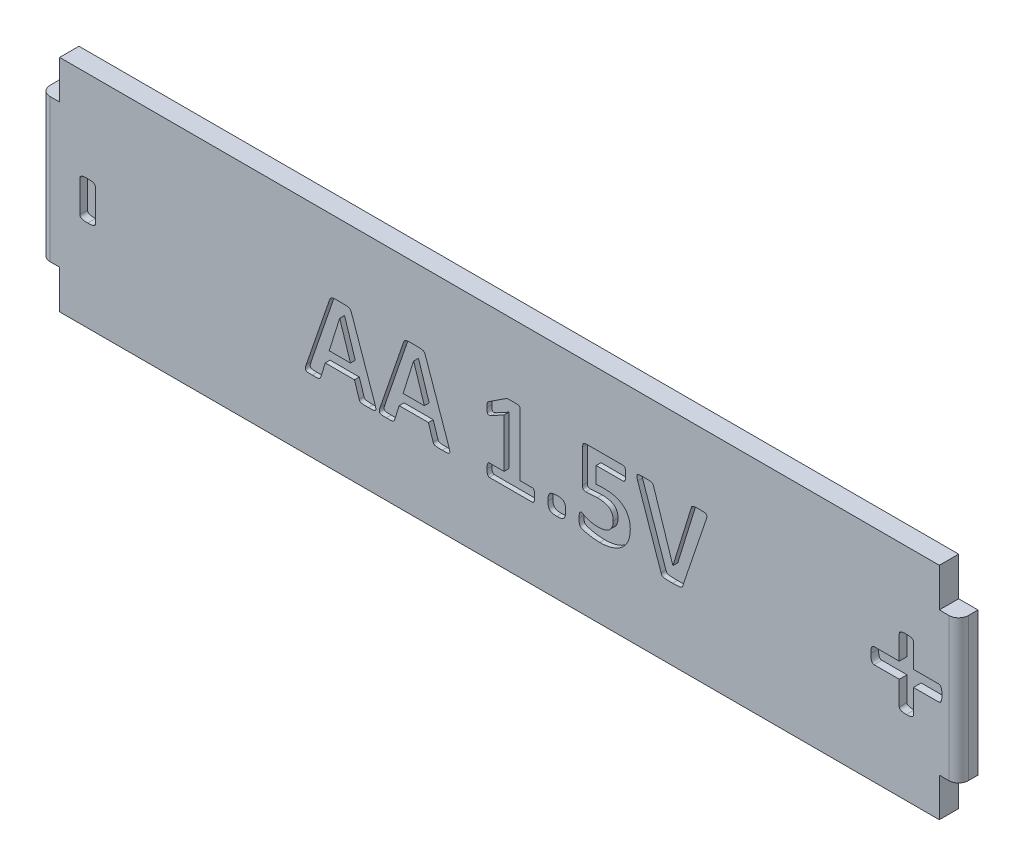
from build123d import *

# Parameters (mm, degrees)
BOSS_EXTRUDE1_DEPTH = 1
FILLET1_R           = 0.5
CUT_EXTRUDE1_DEPTH  = 0.25
SKETCH4_W           = 2.1
SKETCH4_H           = 2.1
CUT_EXTRUDE3_DEPTH  = 0.7
FILLET2_R           = 0.4
CUT_EXTRUDE4_DEPTH  = 0.4


with BuildPart() as part:
    # Sketch1 → Boss-Extrude1 (new body)
    with BuildSketch(Plane.XY):
        Polygon((-22.75, -5.7), (22.75, -5.7), (22.75, -3.7), (23.75, -3.7), (23.75, 3.7), (22.75, 3.7), (22.75, 5.7), (-22.75, 5.7), (-22.75, 3.7), (-23.75, 3.7), (-23.75, -3.7), (-22.75, -3.7), align=None)
    extrude(amount=BOSS_EXTRUDE1_DEPTH)

    # Fillet1
    fillet1_edges = [part.edges().sort_by_distance(p)[0] for p in [
        (-23.75, 0, 1),
        (23.75, 0, 1),
    ]]
    fillet(fillet1_edges, radius=FILLET1_R)

    # Sketch2 → Cut-Extrude1 (cut)
    # profile 1 of 6: a face of its own
    with BuildSketch(Plane.XY.offset(1)):
        with BuildLine():
            add(Edge.make_bspline(
                [(-6.441176471, -1.681066176), (-6.43514215, -1.698463246), (-6.423893064, -1.73089459), (-6.411134097, -1.777714399), (-6.400914328, -1.81840243), (-6.393947438, -1.853881891), (-6.391326647, -1.884608418), (-6.39520632, -1.911109035), (-6.403122486, -1.934523301), (-6.418807872, -1.953302348), (-6.439899264, -1.968606454), (-6.467908333, -1.979050301), (-6.501623162, -1.988432883), (-6.542462837, -1.993400755), (-6.590374631, -1.995378977), (-6.645792762, -1.998848309), (-6.709870331, -1.998953944), (-6.755210304, -1.999635957), (-6.779411765, -2)],
                knots=[0, 0, 0, 0, 1.351975101, 2.52033068, 3.562719996, 4.432170766, 5.176088948, 5.812532786, 6.389296298, 6.965620705, 7.577732788, 8.283941723, 9.146375963, 10.145613058, 11.295182858, 12.669444765, 14.222224263, 16, 16, 16, 16], degree=3))
            add(Edge.make_bspline(
                [(-6.779411765, -2), (-6.804227611, -2.000059076), (-6.851104114, -2.000170668), (-6.916990313, -1.999438733), (-6.974262144, -1.997235534), (-7.035664591, -1.995552473), (-7.097179219, -1.989698559), (-7.156329437, -1.980048369), (-7.198777842, -1.963881988), (-7.227688195, -1.940038839), (-7.24419154, -1.908504263), (-7.252150138, -1.886125934), (-7.256433824, -1.874080882)],
                knots=[0, 0, 0, 0, 1.402041787, 2.648421349, 3.722147351, 4.640185661, 6.117966101, 7.211050041, 8.017924191, 8.656254393, 9.276733986, 10, 10, 10, 10], degree=3))
            Line((-7.256433824, -1.874080882), (-7.500919118, -1.117647059))
            Line((-7.500919118, -1.117647059), (-9.010110294, -1.117647059))
            Line((-9.010110294, -1.117647059), (-9.241727941, -1.852941176))
            add(Edge.make_bspline(
                [(-9.241727941, -1.852941176), (-9.245919816, -1.86624811), (-9.253902368, -1.891588393), (-9.272028902, -1.926589366), (-9.301223981, -1.954190463), (-9.342387527, -1.974913155), (-9.399235471, -1.987349905), (-9.473663173, -1.996392786), (-9.570163526, -1.998447493), (-9.641859217, -1.999442899), (-9.681985294, -2)],
                knots=[0, 0, 0, 0, 0.662368552, 1.261342941, 1.847645799, 2.537239812, 3.42265718, 4.595262896, 6.094463672, 8, 8, 8, 8], degree=3))
            add(Edge.make_bspline(
                [(-9.681985294, -2), (-9.704351499, -1.999769411), (-9.746640373, -1.999333426), (-9.806400512, -1.997568311), (-9.858491194, -1.994780433), (-9.903390712, -1.991668492), (-9.941045498, -1.985572768), (-9.97271125, -1.976296067), (-9.998311499, -1.964078749), (-10.024660548, -1.942534901), (-10.042135205, -1.900772413), (-10.040106686, -1.839358846), (-10.02070276, -1.763253372), (-10.002794458, -1.706685478), (-9.992647059, -1.674632353)],
                knots=[0, 0, 0, 0, 1.279822224, 2.419822313, 3.420424811, 4.264789446, 4.993926375, 5.598399463, 6.14718048, 6.607326483, 7.517039103, 8.604050794, 10.075749779, 12, 12, 12, 12], degree=3))
            Line((-9.992647059, -1.674632353), (-8.783088235, 1.840992647))
            add(Edge.make_bspline(
                [(-8.783088235, 1.840992647), (-8.776768306, 1.856793782), (-8.765081152, 1.886014088), (-8.741799782, 1.925905888), (-8.706874844, 1.95706308), (-8.656070861, 1.97630304), (-8.589651982, 1.990860253), (-8.521210497, 1.995308723), (-8.45527723, 1.997267632), (-8.395539456, 1.99939096), (-8.328127436, 2.000182536), (-8.280637372, 2.000063154), (-8.255514706, 2)],
                knots=[0, 0, 0, 0, 0.856868194, 1.584566637, 2.305859304, 3.162727498, 4.285524966, 5.725550839, 6.605441018, 7.608682037, 8.734971556, 10, 10, 10, 10], degree=3))
            add(Edge.make_bspline(
                [(-8.255514706, 2), (-8.226715577, 2.000060532), (-8.171872879, 2.000175804), (-8.094351935, 1.999407864), (-8.026033407, 1.997289207), (-7.951534629, 1.995274375), (-7.875169887, 1.991036748), (-7.80104759, 1.976372259), (-7.745233752, 1.95675726), (-7.706343614, 1.924201189), (-7.681056865, 1.881268088), (-7.669740277, 1.849195453), (-7.663602941, 1.831801471)],
                knots=[0, 0, 0, 0, 1.298203691, 2.47219252, 3.494555852, 4.378870695, 5.833194716, 6.932857721, 7.781737059, 8.467837287, 9.169060755, 10, 10, 10, 10], degree=3))
            Line((-7.663602941, 1.831801471), (-6.441176471, -1.681066176))
        make_face()
        Polygon((-8.264705882, 1.252757353), (-8.267463235, 1.252757353), (-8.806985294, -0.470588235), (-7.709558824, -0.470588235), align=None, mode=Mode.SUBTRACT)
    # profile 2 of 6: a face of its own
    with BuildSketch(Plane.XY.offset(1)):
        with BuildLine():
            add(Edge.make_bspline(
                [(-2.617647059, -1.681066176), (-2.611612738, -1.698463246), (-2.600363653, -1.73089459), (-2.587604685, -1.777714399), (-2.577384916, -1.81840243), (-2.570418026, -1.853881891), (-2.567797235, -1.884608418), (-2.571676909, -1.911109035), (-2.579593074, -1.934523301), (-2.59527846, -1.953302348), (-2.616369852, -1.968606454), (-2.644378921, -1.979050301), (-2.67809375, -1.988432883), (-2.718933426, -1.993400755), (-2.76684522, -1.995378977), (-2.82226335, -1.998848309), (-2.886340919, -1.998953944), (-2.931680892, -1.999635957), (-2.955882353, -2)],
                knots=[0, 0, 0, 0, 1.351975101, 2.52033068, 3.562719996, 4.432170766, 5.176088948, 5.812532786, 6.389296298, 6.965620705, 7.577732788, 8.283941723, 9.146375963, 10.145613058, 11.295182858, 12.669444765, 14.222224263, 16, 16, 16, 16], degree=3))
            add(Edge.make_bspline(
                [(-2.955882353, -2), (-2.980698199, -2.000059076), (-3.027574703, -2.000170668), (-3.093460901, -1.999438733), (-3.150732732, -1.997235534), (-3.212135179, -1.995552473), (-3.273649807, -1.989698559), (-3.332800026, -1.980048369), (-3.37524843, -1.963881988), (-3.404158783, -1.940038839), (-3.420662129, -1.908504263), (-3.428620726, -1.886125934), (-3.432904412, -1.874080882)],
                knots=[0, 0, 0, 0, 1.402041787, 2.648421349, 3.722147351, 4.640185661, 6.117966101, 7.211050041, 8.017924191, 8.656254393, 9.276733986, 10, 10, 10, 10], degree=3))
            Line((-3.432904412, -1.874080882), (-3.677389706, -1.117647059))
            Line((-3.677389706, -1.117647059), (-5.186580882, -1.117647059))
            Line((-5.186580882, -1.117647059), (-5.418198529, -1.852941176))
            add(Edge.make_bspline(
                [(-5.418198529, -1.852941176), (-5.422390404, -1.86624811), (-5.430372956, -1.891588393), (-5.44849949, -1.926589366), (-5.477694569, -1.954190463), (-5.518858115, -1.974913155), (-5.57570606, -1.987349905), (-5.650133761, -1.996392786), (-5.746634114, -1.998447493), (-5.818329805, -1.999442899), (-5.858455882, -2)],
                knots=[0, 0, 0, 0, 0.662368552, 1.261342941, 1.847645799, 2.537239812, 3.42265718, 4.595262896, 6.094463672, 8, 8, 8, 8], degree=3))
            add(Edge.make_bspline(
                [(-5.858455882, -2), (-5.880822087, -1.999769411), (-5.923110961, -1.999333426), (-5.9828711, -1.997568311), (-6.034961783, -1.994780433), (-6.0798613, -1.991668492), (-6.117516086, -1.985572768), (-6.149181838, -1.976296067), (-6.174782087, -1.964078749), (-6.201131136, -1.942534901), (-6.218605793, -1.900772413), (-6.216577274, -1.839358846), (-6.197173348, -1.763253372), (-6.179265047, -1.706685478), (-6.169117647, -1.674632353)],
                knots=[0, 0, 0, 0, 1.279822224, 2.419822313, 3.420424811, 4.264789446, 4.993926375, 5.598399463, 6.14718048, 6.607326483, 7.517039103, 8.604050794, 10.075749779, 12, 12, 12, 12], degree=3))
            Line((-6.169117647, -1.674632353), (-4.959558824, 1.840992647))
            add(Edge.make_bspline(
                [(-4.959558824, 1.840992647), (-4.953238894, 1.856793782), (-4.941551741, 1.886014088), (-4.91827037, 1.925905888), (-4.883345433, 1.95706308), (-4.83254145, 1.97630304), (-4.76612257, 1.990860253), (-4.697681085, 1.995308723), (-4.631747818, 1.997267632), (-4.572010044, 1.99939096), (-4.504598024, 2.000182536), (-4.45710796, 2.000063154), (-4.431985294, 2)],
                knots=[0, 0, 0, 0, 0.856868194, 1.584566637, 2.305859304, 3.162727498, 4.285524966, 5.725550839, 6.605441018, 7.608682037, 8.734971556, 10, 10, 10, 10], degree=3))
            add(Edge.make_bspline(
                [(-4.431985294, 2), (-4.403186165, 2.000060532), (-4.348343467, 2.000175804), (-4.270822524, 1.999407864), (-4.202503995, 1.997289207), (-4.128005217, 1.995274375), (-4.051640475, 1.991036748), (-3.977518178, 1.976372259), (-3.92170434, 1.95675726), (-3.882814203, 1.924201189), (-3.857527453, 1.881268088), (-3.846210865, 1.849195453), (-3.840073529, 1.831801471)],
                knots=[0, 0, 0, 0, 1.298203691, 2.47219252, 3.494555852, 4.378870695, 5.833194716, 6.932857721, 7.781737059, 8.467837287, 9.169060755, 10, 10, 10, 10], degree=3))
            Line((-3.840073529, 1.831801471), (-2.617647059, -1.681066176))
        make_face()
        Polygon((-4.441176471, 1.252757353), (-4.443933824, 1.252757353), (-4.983455882, -0.470588235), (-3.886029412, -0.470588235), align=None, mode=Mode.SUBTRACT)
    # profile 3 of 6: a face of its own
    with BuildSketch(Plane.XY.offset(1)):
        with BuildLine():
            add(Edge.make_bspline(
                [(1.823529412, -1.681066176), (1.823463336, -1.708670782), (1.823341898, -1.759404012), (1.815553837, -1.828767687), (1.805678764, -1.885535073), (1.79009576, -1.929490513), (1.771757062, -1.962408316), (1.750141338, -1.984620328), (1.725346823, -1.998330266), (1.707581573, -1.999436385), (1.698529412, -2)],
                knots=[0, 0, 0, 0, 1.769380938, 3.251863504, 4.473793643, 5.456147252, 6.231459106, 6.87077347, 7.424610359, 8, 8, 8, 8], degree=3))
            Line((1.698529412, -2), (-0.525735294, -2))
            add(Edge.make_bspline(
                [(-0.525735294, -2), (-0.533828139, -1.999297033), (-0.550589773, -1.99784107), (-0.574550612, -1.984881933), (-0.595190944, -1.962021237), (-0.613710959, -1.929566078), (-0.629121518, -1.885502034), (-0.639390772, -1.828835037), (-0.645359368, -1.759317359), (-0.646459683, -1.7086535), (-0.647058824, -1.681066176)],
                knots=[0, 0, 0, 0, 0.521835169, 1.080807807, 1.712179375, 2.494680724, 3.486143732, 4.719404872, 6.213660719, 8, 8, 8, 8], degree=3))
            add(Edge.make_bspline(
                [(-0.647058824, -1.681066176), (-0.646699586, -1.652881612), (-0.646042735, -1.601347219), (-0.641661078, -1.530748077), (-0.630471054, -1.473814673), (-0.616373386, -1.428606742), (-0.597911975, -1.3945121), (-0.576675694, -1.36995921), (-0.55104218, -1.355766058), (-0.532935014, -1.353881719), (-0.523897059, -1.352941176)],
                knots=[0, 0, 0, 0, 1.773338699, 3.242481697, 4.440534656, 5.415572, 6.2091949, 6.863837362, 7.432899261, 8, 8, 8, 8], degree=3))
            Line((-0.523897059, -1.352941176), (0.235294118, -1.352941176))
            Line((0.235294118, -1.352941176), (0.235294118, 1.176470588))
            Line((0.235294118, 1.176470588), (-0.413602941, 0.823529412))
            add(Edge.make_bspline(
                [(-0.413602941, 0.823529412), (-0.435180914, 0.813929222), (-0.473063436, 0.797075026), (-0.525404981, 0.779751125), (-0.569906652, 0.778341719), (-0.606701336, 0.798574373), (-0.627952931, 0.840667044), (-0.640718068, 0.899595145), (-0.645197908, 0.981284747), (-0.646382661, 1.043523314), (-0.647058824, 1.079044118)],
                knots=[0, 0, 0, 0, 1.16110972, 2.038456742, 2.701448753, 3.288176025, 3.990880841, 4.937165991, 6.251978929, 8, 8, 8, 8], degree=3))
            add(Edge.make_bspline(
                [(-0.647058824, 1.079044118), (-0.646781225, 1.102022887), (-0.646281444, 1.143393247), (-0.645211146, 1.200180263), (-0.64033152, 1.246908359), (-0.629930775, 1.285869035), (-0.615948122, 1.31858159), (-0.594674676, 1.345227508), (-0.567314188, 1.368798158), (-0.546413484, 1.383476764), (-0.534926471, 1.391544118)],
                knots=[0, 0, 0, 0, 1.56313437, 2.814225196, 3.86369772, 4.748352527, 5.550351806, 6.263187403, 7.045448883, 8, 8, 8, 8], degree=3))
            Line((-0.534926471, 1.391544118), (0.330882353, 1.958639706))
            add(Edge.make_bspline(
                [(0.330882353, 1.958639706), (0.33651643, 1.96297208), (0.348423394, 1.972128048), (0.372033438, 1.979454741), (0.399727977, 1.987326536), (0.435261215, 1.992312861), (0.47963741, 1.997426151), (0.536478022, 1.997983825), (0.607818924, 2.000715495), (0.660839787, 2.000255319), (0.690257353, 2)],
                knots=[0, 0, 0, 0, 0.462162572, 0.976726718, 1.600024173, 2.352504238, 3.321320859, 4.526493399, 6.072794308, 8, 8, 8, 8], degree=3))
            add(Edge.make_bspline(
                [(0.690257353, 2), (0.726419743, 1.999966625), (0.790802162, 1.999907206), (0.876915163, 1.996350072), (0.942865406, 1.990790148), (0.991011383, 1.981507782), (1.025867207, 1.971400808), (1.046692212, 1.95277177), (1.05812401, 1.930396795), (1.058580088, 1.914054145), (1.058823529, 1.905330882)],
                knots=[0, 0, 0, 0, 2.095956985, 3.731578029, 4.998773625, 5.921870021, 6.585026704, 7.062945429, 7.499825718, 8, 8, 8, 8], degree=3))
            Line((1.058823529, 1.905330882), (1.058823529, -1.352941176))
            Line((1.058823529, -1.352941176), (1.701286765, -1.352941176))
            add(Edge.make_bspline(
                [(1.701286765, -1.352941176), (1.710325078, -1.353881658), (1.72843296, -1.355765873), (1.754060818, -1.369959998), (1.775323592, -1.394508331), (1.793652335, -1.428625792), (1.808393488, -1.473613242), (1.816142349, -1.531053339), (1.823184393, -1.601237293), (1.823407471, -1.652851985), (1.823529412, -1.681066176)],
                knots=[0, 0, 0, 0, 0.567469369, 1.136901174, 1.79196917, 2.586107946, 3.56177909, 4.753767401, 6.225508585, 8, 8, 8, 8], degree=3))
        make_face()
    # profile 4 of 6: a face of its own
    with BuildSketch(Plane.XY.offset(1)):
        with BuildLine():
            add(Edge.make_bspline(
                [(3.426470588, -1.522058824), (3.425334538, -1.565313272), (3.423251243, -1.644633563), (3.406376522, -1.753050052), (3.374964728, -1.839072629), (3.329068465, -1.905449491), (3.263096851, -1.950018064), (3.180369057, -1.978983157), (3.078571201, -1.99695643), (3.004374792, -1.998930109), (2.964154412, -2)],
                knots=[0, 0, 0, 0, 1.323068279, 2.426251239, 3.340001497, 4.10483292, 4.851122683, 5.73193367, 6.770526866, 8, 8, 8, 8], degree=3))
            add(Edge.make_bspline(
                [(2.964154412, -2), (2.923965572, -1.998800388), (2.850183052, -1.996598027), (2.74865283, -1.98029781), (2.667169587, -1.950469499), (2.601428274, -1.907764129), (2.55624685, -1.842974933), (2.526180231, -1.760236588), (2.508569111, -1.656968489), (2.506592775, -1.581570143), (2.505514706, -1.540441176)],
                knots=[0, 0, 0, 0, 1.260381193, 2.313928451, 3.207892944, 3.967434409, 4.730310535, 5.636682539, 6.710836379, 8, 8, 8, 8], degree=3))
            add(Edge.make_bspline(
                [(2.505514706, -1.540441176), (2.505895852, -1.517454203), (2.50662338, -1.473576869), (2.511305012, -1.410688065), (2.51830138, -1.353504139), (2.528905718, -1.301974357), (2.543958123, -1.257036021), (2.560136646, -1.217405117), (2.580512398, -1.18384149), (2.613094487, -1.14589535), (2.668942946, -1.109321961), (2.751805463, -1.078012297), (2.855152152, -1.062496621), (2.93011193, -1.060111456), (2.970588235, -1.058823529)],
                knots=[0, 0, 0, 0, 1.044801848, 1.994308651, 2.86486239, 3.66240745, 4.380225021, 5.016556715, 5.604084364, 6.156920489, 7.277228811, 8.590980571, 10.159219326, 12, 12, 12, 12], degree=3))
            add(Edge.make_bspline(
                [(2.970588235, -1.058823529), (3.010162929, -1.060060867), (3.083329319, -1.062348479), (3.183965108, -1.078409797), (3.265372659, -1.108400438), (3.33029664, -1.152046809), (3.37578326, -1.216699336), (3.405923214, -1.299809933), (3.423432846, -1.404004494), (3.425396507, -1.4803173), (3.426470588, -1.522058824)],
                knots=[0, 0, 0, 0, 1.240265454, 2.293024596, 3.177350613, 3.941829253, 4.704134702, 5.609828685, 6.692625838, 8, 8, 8, 8], degree=3))
        make_face()
    # profile 5 of 6: a face of its own
    with BuildSketch(Plane.XY.offset(1)):
        with BuildLine():
            add(Edge.make_bspline(
                [(6.764705882, -0.693933824), (6.763276245, -0.746394302), (6.760480127, -0.848997733), (6.73911744, -0.998792304), (6.703420883, -1.139965833), (6.653458704, -1.27208329), (6.591243282, -1.394742318), (6.515456697, -1.506995234), (6.429465703, -1.610509816), (6.330068054, -1.702660077), (6.220196673, -1.784602369), (6.099854892, -1.856783072), (5.968812539, -1.918125128), (5.82799117, -1.969563543), (5.678235116, -2.009940812), (5.519839318, -2.038017081), (5.353666986, -2.056058848), (5.239937917, -2.057890287), (5.181985294, -2.058823529)],
                knots=[0, 0, 0, 0, 1.06697082, 2.086806491, 3.070914618, 4.02363306, 4.954656601, 5.862205625, 6.773556322, 7.686376441, 8.612568136, 9.557486927, 10.536112515, 11.55159642, 12.603902796, 13.687080049, 14.821411453, 16, 16, 16, 16], degree=3))
            add(Edge.make_bspline(
                [(5.181985294, -2.058823529), (5.120984123, -2.057748267), (5.002144856, -2.055653497), (4.829900949, -2.039976823), (4.671160012, -2.01498533), (4.52898044, -1.985620594), (4.408080634, -1.951815577), (4.322288619, -1.923053408), (4.266232293, -1.901185346), (4.235138452, -1.885444989), (4.20982286, -1.872892725), (4.187540781, -1.856460964), (4.167692515, -1.834726845), (4.150299971, -1.806298785), (4.139893859, -1.773348287), (4.130037911, -1.735753853), (4.124409937, -1.690064234), (4.119433998, -1.634913473), (4.11848825, -1.569236839), (4.117940388, -1.521748872), (4.117647059, -1.496323529)],
                knots=[0, 0, 0, 0, 2.352153803, 4.582342044, 6.662667079, 8.546514862, 10.177514967, 11.500105838, 12.035421318, 12.4951253, 12.844003289, 13.122835489, 13.557570542, 13.970909211, 14.396887048, 14.884011341, 15.46879923, 16.168353294, 17.019325374, 18, 18, 18, 18], degree=3))
            add(Edge.make_bspline(
                [(4.117647059, -1.496323529), (4.11815898, -1.46875123), (4.119092323, -1.418480881), (4.121759495, -1.349308122), (4.129665503, -1.293201714), (4.141407408, -1.248575284), (4.156286357, -1.215200417), (4.174385413, -1.191913313), (4.196115696, -1.178344193), (4.211842285, -1.17709319), (4.219669118, -1.176470588)],
                knots=[0, 0, 0, 0, 1.822902001, 3.323550125, 4.572139576, 5.559599618, 6.365772599, 6.969872283, 7.487324433, 8, 8, 8, 8], degree=3))
            add(Edge.make_bspline(
                [(4.219669118, -1.176470588), (4.233063378, -1.178915991), (4.266810201, -1.185077181), (4.320369269, -1.217583618), (4.393363041, -1.255403321), (4.487377815, -1.298132887), (4.602998218, -1.339676482), (4.713706248, -1.371749136), (4.814553915, -1.391715085), (4.900392937, -1.404063983), (4.993797776, -1.40974194), (5.058512688, -1.411076134), (5.091911765, -1.411764706)],
                knots=[0, 0, 0, 0, 0.444011661, 1.118686809, 2.027427457, 3.152785246, 4.501835654, 6.058794642, 6.93060907, 7.875047181, 8.903321363, 10, 10, 10, 10], degree=3))
            add(Edge.make_bspline(
                [(5.091911765, -1.411764706), (5.148996627, -1.410158846), (5.258738251, -1.407071694), (5.391844815, -1.383484952), (5.488307064, -1.353027283), (5.554761735, -1.327558433), (5.614280615, -1.293300922), (5.668769652, -1.254883342), (5.717910596, -1.210746465), (5.760069077, -1.160468234), (5.79757794, -1.106075996), (5.827590595, -1.045503021), (5.853250394, -0.979672132), (5.869962732, -0.907245516), (5.880281671, -0.828729727), (5.881643595, -0.774545122), (5.882352941, -0.746323529)],
                knots=[0, 0, 0, 0, 2.032782473, 3.907880992, 4.788067796, 5.635158135, 6.436515337, 7.226873511, 8.007222909, 8.781366493, 9.559270127, 10.354810048, 11.183780612, 12.070505633, 12.995039183, 14, 14, 14, 14], degree=3))
            add(Edge.make_bspline(
                [(5.882352941, -0.746323529), (5.881829138, -0.721794804), (5.880811094, -0.67412169), (5.872776009, -0.60476126), (5.857714524, -0.539930063), (5.837727712, -0.478714355), (5.811169927, -0.421937022), (5.77842803, -0.369269068), (5.739060007, -0.32142244), (5.692017438, -0.279052122), (5.639522924, -0.239541086), (5.578496672, -0.207029243), (5.510628962, -0.179461997), (5.435692826, -0.156200809), (5.352791941, -0.13946406), (5.262005116, -0.126267036), (5.162789511, -0.11937546), (5.093758866, -0.118237904), (5.057904412, -0.117647059)],
                knots=[0, 0, 0, 0, 0.990747943, 1.925580712, 2.814217929, 3.675193293, 4.522270198, 5.339531786, 6.174590224, 7.015406179, 7.891633713, 8.822032467, 9.798768499, 10.847855848, 11.98621392, 13.211340836, 14.551572957, 16, 16, 16, 16], degree=3))
            add(Edge.make_bspline(
                [(5.057904412, -0.117647059), (5.001176679, -0.118305369), (4.892747981, -0.119563656), (4.737963684, -0.135104105), (4.595625763, -0.151899338), (4.504030935, -0.153590603), (4.459558824, -0.154411765)],
                knots=[0, 0, 0, 0, 1.134417109, 2.168311031, 3.110658559, 4, 4, 4, 4], degree=3))
            add(Edge.make_bspline(
                [(4.459558824, -0.154411765), (4.445717647, -0.153984755), (4.419891625, -0.153188004), (4.384026353, -0.144758192), (4.353988549, -0.131483976), (4.329760124, -0.110698602), (4.313450185, -0.081398625), (4.30127413, -0.04437977), (4.296030262, 0.001704223), (4.294787654, 0.03523124), (4.294117647, 0.053308824)],
                knots=[0, 0, 0, 0, 1.070487309, 1.997404571, 2.836260287, 3.593209122, 4.423627128, 5.399401485, 6.59777159, 8, 8, 8, 8], degree=3))
            Line((4.294117647, 0.053308824), (4.294117647, 1.771139706))
            add(Edge.make_bspline(
                [(4.294117647, 1.771139706), (4.294444374, 1.790187018), (4.295049825, 1.825483201), (4.304433576, 1.874105566), (4.318607092, 1.914779381), (4.340088433, 1.947545097), (4.36984738, 1.971598971), (4.405558828, 1.989089555), (4.449060775, 1.997792803), (4.479747837, 1.999225906), (4.496323529, 2)],
                knots=[0, 0, 0, 0, 1.291048597, 2.392415675, 3.346680984, 4.200455207, 5.012683301, 5.914987328, 6.873775246, 8, 8, 8, 8], degree=3))
            Line((4.496323529, 2), (6.401654412, 2))
            add(Edge.make_bspline(
                [(6.401654412, 2), (6.411054855, 1.999156219), (6.43042298, 1.997417741), (6.456740563, 1.980871924), (6.481042529, 1.956083932), (6.498311315, 1.918439768), (6.513406417, 1.870425831), (6.522221176, 1.809370655), (6.528962345, 1.735145541), (6.529253314, 1.681090675), (6.529411765, 1.651654412)],
                knots=[0, 0, 0, 0, 0.553923566, 1.141271771, 1.798199546, 2.596456404, 3.569952235, 4.788584081, 6.251182718, 8, 8, 8, 8], degree=3))
            add(Edge.make_bspline(
                [(6.529411765, 1.651654412), (6.529201964, 1.622533356), (6.528810455, 1.568190398), (6.522447566, 1.493265385), (6.512868532, 1.431023755), (6.499525637, 1.381431358), (6.482217521, 1.342814123), (6.460231587, 1.315338552), (6.433736718, 1.297400147), (6.414152731, 1.295208006), (6.404411765, 1.294117647)],
                knots=[0, 0, 0, 0, 1.705538939, 3.182715304, 4.401402576, 5.39006858, 6.184910218, 6.860567929, 7.433252789, 8, 8, 8, 8], degree=3))
            Line((6.404411765, 1.294117647), (5, 1.294117647))
            Line((5, 1.294117647), (5, 0.452205882))
            add(Edge.make_bspline(
                [(5, 0.452205882), (5.035512545, 0.455894874), (5.105817572, 0.46319806), (5.212565292, 0.468569795), (5.321381359, 0.469741937), (5.395220775, 0.470302271), (5.432904412, 0.470588235)],
                knots=[0, 0, 0, 0, 0.98809062, 1.956146446, 2.956927895, 4, 4, 4, 4], degree=3))
            add(Edge.make_bspline(
                [(5.432904412, 0.470588235), (5.484708247, 0.46971893), (5.585750645, 0.468023366), (5.732688717, 0.454520041), (5.870585643, 0.430406742), (5.999542288, 0.39771673), (6.119139265, 0.355397019), (6.229844089, 0.304962821), (6.330032155, 0.244398713), (6.419930324, 0.174559609), (6.500902926, 0.09752879), (6.570041393, 0.009712301), (6.63020205, -0.085818472), (6.678977411, -0.190967803), (6.71765703, -0.304303961), (6.745008159, -0.426630077), (6.761755162, -0.557438363), (6.763704679, -0.647619825), (6.764705882, -0.693933824)],
                knots=[0, 0, 0, 0, 1.233638519, 2.406188574, 3.509786213, 4.564519873, 5.570688591, 6.527218667, 7.456964246, 8.351604632, 9.23399176, 10.111417538, 11.006266177, 11.916948856, 12.865290053, 13.852981671, 14.897367593, 16, 16, 16, 16], degree=3))
        make_face()
    # profile 6 of 6: a face of its own
    with BuildSketch(Plane.XY.offset(1)):
        with BuildLine():
            add(Edge.make_bspline(
                [(9.483455882, -1.840992647), (9.478265376, -1.85687511), (9.468576219, -1.886523021), (9.444802504, -1.925885099), (9.409469242, -1.957408547), (9.357854748, -1.977438501), (9.289542924, -1.990449667), (9.220671267, -1.99530384), (9.15441632, -1.997279802), (9.095295241, -1.999377575), (9.028494865, -2.000185885), (8.981617678, -2.000064343), (8.956801471, -2)],
                knots=[0, 0, 0, 0, 0.838483291, 1.565202924, 2.285525397, 3.175638207, 4.308717692, 5.77750847, 6.640818347, 7.642709929, 8.752079542, 10, 10, 10, 10], degree=3))
            add(Edge.make_bspline(
                [(8.956801471, -2), (8.918198957, -2.00005542), (8.846813513, -2.000157906), (8.747833446, -1.999511702), (8.664444765, -1.997107062), (8.595022583, -1.992083258), (8.53834466, -1.983534406), (8.492013449, -1.974366334), (8.455172282, -1.959940345), (8.424796533, -1.943728765), (8.401076636, -1.922863469), (8.382470347, -1.897500911), (8.369491403, -1.86625446), (8.361695178, -1.843785921), (8.357536765, -1.831801471)],
                knots=[0, 0, 0, 0, 2.065956449, 3.8204564, 5.296959174, 6.530624034, 7.541636879, 8.365060191, 9.0501898, 9.652188513, 10.19821837, 10.726225753, 11.320584009, 12, 12, 12, 12], degree=3))
            Line((8.357536765, -1.831801471), (7.147058824, 1.681066176))
            add(Edge.make_bspline(
                [(7.147058824, 1.681066176), (7.141530917, 1.698521913), (7.131086803, 1.731501795), (7.116667677, 1.77777089), (7.107955459, 1.818838371), (7.100495242, 1.85381229), (7.098742699, 1.884820042), (7.104762289, 1.911323281), (7.1146732, 1.934716117), (7.132307499, 1.953659856), (7.156344498, 1.968710273), (7.187268251, 1.979016761), (7.22423424, 1.987219122), (7.268272732, 1.992395453), (7.320121419, 1.995703421), (7.381093977, 1.998775044), (7.451290349, 1.998968526), (7.501226865, 1.99964375), (7.527573529, 2)],
                knots=[0, 0, 0, 0, 1.275097074, 2.409096461, 3.37162946, 4.195875074, 4.900146373, 5.510995092, 6.074169784, 6.648148811, 7.281310597, 8.030356235, 8.9049585, 9.915687935, 11.113310156, 12.522660173, 14.165344402, 16, 16, 16, 16], degree=3))
            add(Edge.make_bspline(
                [(7.527573529, 2), (7.550248607, 2.000202481), (7.592850409, 2.000582901), (7.652876494, 1.998095569), (7.705003149, 1.996760205), (7.761436347, 1.99312423), (7.818420507, 1.987639164), (7.873417214, 1.975236153), (7.914596214, 1.957083441), (7.939272817, 1.92622329), (7.956627326, 1.890682635), (7.965686465, 1.864403233), (7.970588235, 1.850183824)],
                knots=[0, 0, 0, 0, 1.327706146, 2.494486448, 3.517808369, 4.380703587, 5.807288056, 6.860376529, 7.686876677, 8.373845822, 9.120111207, 10, 10, 10, 10], degree=3))
            Line((7.970588235, 1.850183824), (8.967830882, -1.206801471))
            Line((8.967830882, -1.206801471), (8.970588235, -1.206801471))
            Line((8.970588235, -1.206801471), (9.911764706, 1.834558824))
            add(Edge.make_bspline(
                [(9.911764706, 1.834558824), (9.916384677, 1.850544817), (9.924729387, 1.87941913), (9.940554496, 1.919805753), (9.968963597, 1.950752809), (10.010898337, 1.973363684), (10.068666155, 1.9880694), (10.128569857, 1.9931333), (10.187158694, 1.996735395), (10.241729993, 1.998111172), (10.303903398, 2.000568224), (10.348036051, 2.000196269), (10.371323529, 2)],
                knots=[0, 0, 0, 0, 0.926230152, 1.672980775, 2.38414643, 3.207679395, 4.285745138, 5.673211603, 6.542959351, 7.547978764, 8.706141892, 10, 10, 10, 10], degree=3))
            add(Edge.make_bspline(
                [(10.371323529, 2), (10.393990399, 1.99959693), (10.436874141, 1.998834356), (10.497024011, 1.999220697), (10.549016188, 1.994407079), (10.593649588, 1.991749589), (10.631309852, 1.985540014), (10.662683256, 1.976426609), (10.6881275, 1.964186122), (10.712209608, 1.941262975), (10.730261654, 1.900551807), (10.72480326, 1.839589757), (10.706854789, 1.763653279), (10.687512105, 1.707567371), (10.676470588, 1.675551471)],
                knots=[0, 0, 0, 0, 1.300449487, 2.460337065, 3.446878253, 4.293259651, 5.024138121, 5.630054992, 6.164487643, 6.624391872, 7.51295335, 8.602561365, 10.06061698, 12, 12, 12, 12], degree=3))
            Line((10.676470588, 1.675551471), (9.483455882, -1.840992647))
        make_face()
    extrude(amount=-CUT_EXTRUDE1_DEPTH, mode=Mode.SUBTRACT)

    # Sketch4 → Cut-Extrude3 (cut)
    with BuildSketch(Plane(origin=(0, 0, 0), x_dir=(-1, 0, 0), z_dir=(0, 0, -1))):
        with Locations((-13.75, 0)):
            Rectangle(SKETCH4_W, SKETCH4_H)
    extrude(amount=-CUT_EXTRUDE3_DEPTH, mode=Mode.SUBTRACT)

    # Fillet2
    fillet2_edges = [part.edges().sort_by_distance(p)[0] for p in [
        (12.7, 1.05, 0.35),
        (12.7, -1.05, 0.35),
        (14.8, -1.05, 0.35),
        (14.8, 1.05, 0.35),
    ]]
    fillet(fillet2_edges, radius=FILLET2_R)

    # Sketch6 → Cut-Extrude4 (cut)
    with BuildSketch(Plane.XY.offset(1)):
        with BuildLine():
            add(Edge.make_bspline(
                [(21.044117647, 1.764705882), (21.076320947, 1.764112818), (21.13475665, 1.763036651), (21.214382269, 1.75403662), (21.278898399, 1.739996718), (21.329443103, 1.718841936), (21.369138145, 1.69464788), (21.394086828, 1.66308559), (21.40913994, 1.629655859), (21.410891684, 1.606306039), (21.411764706, 1.594669118)],
                knots=[0, 0, 0, 0, 1.726545461, 3.132967738, 4.293853249, 5.251381945, 6.066060523, 6.752573137, 7.378316026, 8, 8, 8, 8], degree=3))
            Line((21.411764706, 1.594669118), (21.411764706, 0.367647059))
            Line((21.411764706, 0.367647059), (22.720358456, 0.367647059))
            add(Edge.make_bspline(
                [(22.720358456, 0.367647059), (22.73241753, 0.366930801), (22.756037857, 0.365527854), (22.789159519, 0.348878873), (22.818047043, 0.320868415), (22.840134308, 0.278478373), (22.859983119, 0.223835481), (22.872498058, 0.153229356), (22.882208826, 0.065759577), (22.88230167, 0.001190232), (22.882352941, -0.034466912)],
                knots=[0, 0, 0, 0, 0.603429104, 1.181947455, 1.823688932, 2.601914784, 3.566798969, 4.748062758, 6.20418199, 8, 8, 8, 8], degree=3))
            add(Edge.make_bspline(
                [(22.882352941, -0.034466912), (22.882268418, -0.070117034), (22.882114458, -0.135054776), (22.872672878, -0.222977779), (22.859689085, -0.294166718), (22.840498298, -0.349534356), (22.817619018, -0.392021998), (22.789585257, -0.421389862), (22.755902803, -0.437600824), (22.732389718, -0.439966165), (22.720358456, -0.441176471)],
                knots=[0, 0, 0, 0, 1.783854375, 3.249343059, 4.422737337, 5.399248707, 6.172290064, 6.8231721, 7.397836394, 8, 8, 8, 8], degree=3))
            Line((22.720358456, -0.441176471), (21.411764706, -0.441176471))
            Line((21.411764706, -0.441176471), (21.411764706, -1.668198529))
            add(Edge.make_bspline(
                [(21.411764706, -1.668198529), (21.410934348, -1.679846074), (21.409293356, -1.70286449), (21.394050643, -1.735575828), (21.36869718, -1.765861269), (21.329520222, -1.79018216), (21.278721608, -1.810990187), (21.214514325, -1.826589475), (21.134822272, -1.836890195), (21.076327375, -1.837757642), (21.044117647, -1.838235294)],
                knots=[0, 0, 0, 0, 0.623807855, 1.232797944, 1.90574625, 2.723208044, 3.68400798, 4.853772554, 6.267556079, 8, 8, 8, 8], degree=3))
            add(Edge.make_bspline(
                [(21.044117647, -1.838235294), (21.01308844, -1.837421654), (20.955509478, -1.835911832), (20.875678708, -1.829005734), (20.810039065, -1.814388101), (20.75844544, -1.795171642), (20.719756282, -1.77240838), (20.693948251, -1.744723647), (20.678989498, -1.713214724), (20.677316378, -1.690945141), (20.676470588, -1.6796875)],
                knots=[0, 0, 0, 0, 1.693799184, 3.143077427, 4.364779368, 5.3504782, 6.139037266, 6.789863577, 7.388256103, 8, 8, 8, 8], degree=3))
            Line((20.676470588, -1.6796875), (20.676470588, -0.441176471))
            Line((20.676470588, -0.441176471), (19.374770221, -0.441176471))
            add(Edge.make_bspline(
                [(19.374770221, -0.441176471), (19.362400124, -0.439859793), (19.337542564, -0.437213944), (19.301325051, -0.421944167), (19.270700084, -0.392519259), (19.246147804, -0.350042068), (19.229149697, -0.293838409), (19.215002557, -0.223120131), (19.208083417, -0.134926242), (19.206662807, -0.070087798), (19.205882353, -0.034466912)],
                knots=[0, 0, 0, 0, 0.613357783, 1.23253503, 1.902617568, 2.675589341, 3.633767173, 4.79252867, 6.237882246, 8, 8, 8, 8], degree=3))
            add(Edge.make_bspline(
                [(19.205882353, -0.034466912), (19.206633597, 0.001160166), (19.207993001, 0.065628627), (19.215172214, 0.153374381), (19.22886367, 0.223499295), (19.246507837, 0.278988934), (19.270282967, 0.32138815), (19.301755474, 0.349388566), (19.337406406, 0.365166766), (19.362372836, 0.366824093), (19.374770221, 0.367647059)],
                knots=[0, 0, 0, 0, 1.77367728, 3.209531927, 4.375894921, 5.322293924, 6.100336406, 6.762033665, 7.385272726, 8, 8, 8, 8], degree=3))
            Line((19.374770221, 0.367647059), (20.676470588, 0.367647059))
            Line((20.676470588, 0.367647059), (20.676470588, 1.607306985))
            add(Edge.make_bspline(
                [(20.676470588, 1.607306985), (20.677395416, 1.617793546), (20.679290509, 1.639281858), (20.694272828, 1.670125009), (20.719271316, 1.698953391), (20.758545197, 1.721494097), (20.809854017, 1.741239937), (20.875956046, 1.753509453), (20.955379018, 1.76301126), (21.013057255, 1.764112729), (21.044117647, 1.764705882)],
                knots=[0, 0, 0, 0, 0.57237495, 1.172869968, 1.841618681, 2.632948401, 3.622110552, 4.843613198, 6.300249541, 8, 8, 8, 8], degree=3))
        make_face()
        with BuildLine():
            add(Edge.make_bspline(
                [(-21.298023897, -0.992647059), (-21.333268437, -0.992379081), (-21.39774436, -0.991888845), (-21.486245633, -0.98433983), (-21.557449892, -0.970912262), (-21.614025177, -0.953813059), (-21.655388155, -0.927471251), (-21.684272963, -0.895237094), (-21.703154004, -0.856595196), (-21.704948653, -0.828194902), (-21.705882353, -0.813419118)],
                knots=[0, 0, 0, 0, 1.706344897, 3.121566203, 4.292558311, 5.213187743, 5.964115776, 6.633972081, 7.289298403, 8, 8, 8, 8], degree=3))
            Line((-21.705882353, -0.813419118), (-21.705882353, 0.808823529))
            add(Edge.make_bspline(
                [(-21.705882353, 0.808823529), (-21.70498653, 0.824366723), (-21.703285155, 0.85388683), (-21.684316379, 0.894258763), (-21.654799615, 0.927665153), (-21.610990705, 0.952071378), (-21.555067486, 0.971172762), (-21.483510126, 0.984299868), (-21.396231562, 0.991850091), (-21.332509233, 0.992367206), (-21.298023897, 0.992647059)],
                knots=[0, 0, 0, 0, 0.74246941, 1.410120505, 2.101485488, 2.853263088, 3.791155757, 4.936211507, 6.34193482, 8, 8, 8, 8], degree=3))
            add(Edge.make_bspline(
                [(-21.298023897, 0.992647059), (-21.263915678, 0.992380124), (-21.200946943, 0.991887324), (-21.114875036, 0.984209368), (-21.04462009, 0.971548219), (-20.990322235, 0.951462209), (-20.946921964, 0.928076291), (-20.918726741, 0.893833062), (-20.89959663, 0.853940966), (-20.897934162, 0.824385396), (-20.897058824, 0.808823529)],
                knots=[0, 0, 0, 0, 1.660740202, 3.06596799, 4.207452398, 5.122322856, 5.883769649, 6.571742844, 7.247981116, 8, 8, 8, 8], degree=3))
            Line((-20.897058824, 0.808823529), (-20.897058824, -0.813419118))
            add(Edge.make_bspline(
                [(-20.897058824, -0.813419118), (-20.897748583, -0.828098492), (-20.899061849, -0.856047268), (-20.914529454, -0.895297032), (-20.943979882, -0.926908479), (-20.985343896, -0.953806354), (-21.042656399, -0.972168512), (-21.113985031, -0.985634439), (-21.201047386, -0.991404233), (-21.263939353, -0.99221024), (-21.298023897, -0.992647059)],
                knots=[0, 0, 0, 0, 0.714742532, 1.36083313, 2.010165004, 2.793572988, 3.746093764, 4.927368113, 6.334775338, 8, 8, 8, 8], degree=3))
        make_face()
    extrude(amount=-CUT_EXTRUDE4_DEPTH, mode=Mode.SUBTRACT)


solid = part.part
